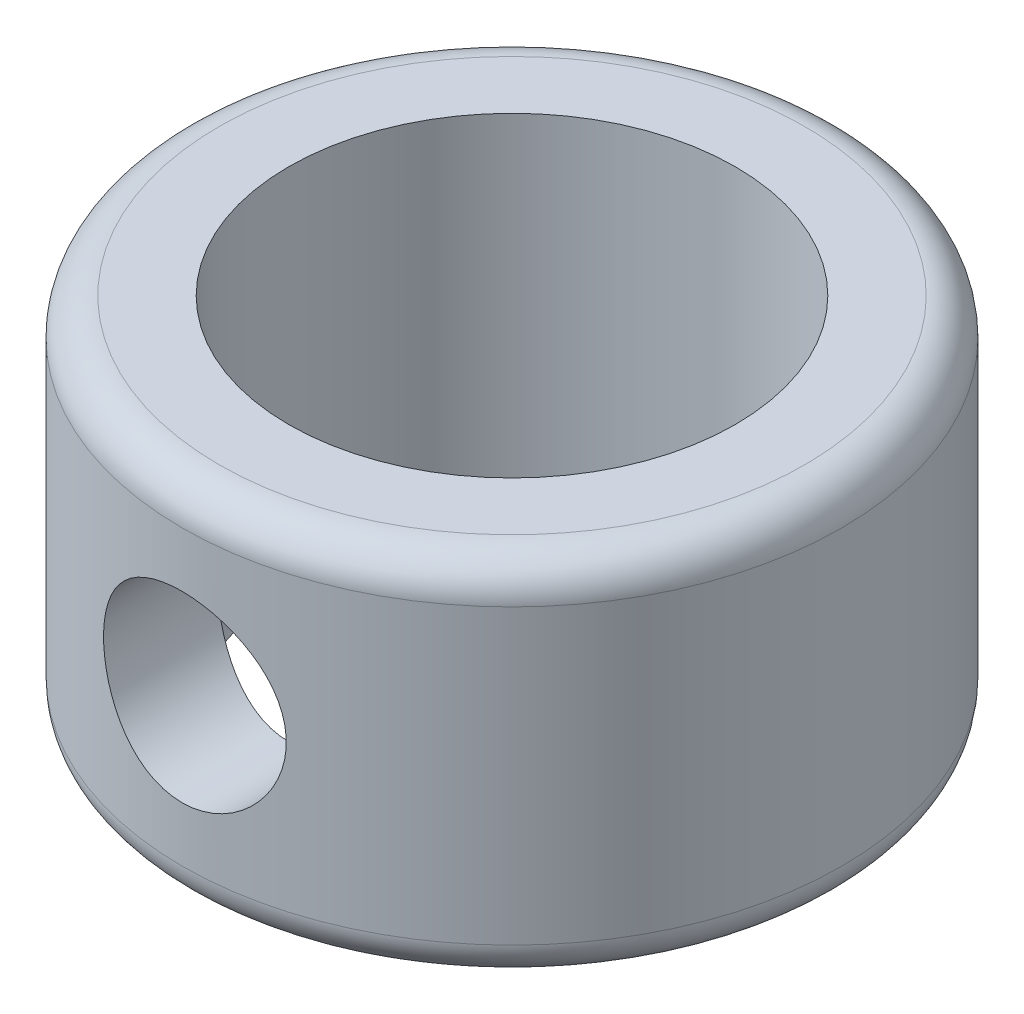
from build123d import *

# Parameters (mm, degrees)
SKETCH1_R                  = 4.5
BOSS_EXTRUDE1_DEPTH        = 5
F_6_1_6_1_DIAMETER_HOLE1_D = 6.1
SKETCH6_W                  = 1.25
SKETCH6_H                  = 4.5
FILLET1_R                  = 0.5


with BuildPart() as part:
    # Sketch1 → Boss-Extrude1 (new body)
    with BuildSketch(Plane(origin=(0, 0, 0), x_dir=(1, 0, 0), z_dir=(0, 1, 0))):
        with Locations(Location((0, 0, 0), (0, 0, 270))):
            Circle(SKETCH1_R)
    extrude(amount=BOSS_EXTRUDE1_DEPTH)

    # Ø6.1 (6.1) Diameter Hole1 (through all)
    with Locations(Plane(origin=(0, 5, 0), x_dir=(1, 0, 0), z_dir=(0, 1, 0))):
        with Locations((0, 0)):
            Hole(F_6_1_6_1_DIAMETER_HOLE1_D / 2)

    # Sketch6 → M3 Tapped Hole1 (revolve, cut)
    with BuildSketch(Plane(origin=(-0.007135696, 2.5, 0), x_dir=(0, 1, 0), z_dir=(1, 0, 0))):
        with Locations((0.625, 2.25)):
            Rectangle(SKETCH6_W, SKETCH6_H)
    revolve(axis=Axis((-0.007135696, 2.5, -6.35), (0, 0, 1)), mode=Mode.SUBTRACT)

    # Fillet1
    fillet1_edges = [part.edges().sort_by_distance(p)[0] for p in [
        (0, 0, -4.5),
        (0, 5, -4.5),
    ]]
    fillet(fillet1_edges, radius=FILLET1_R)


solid = part.part
